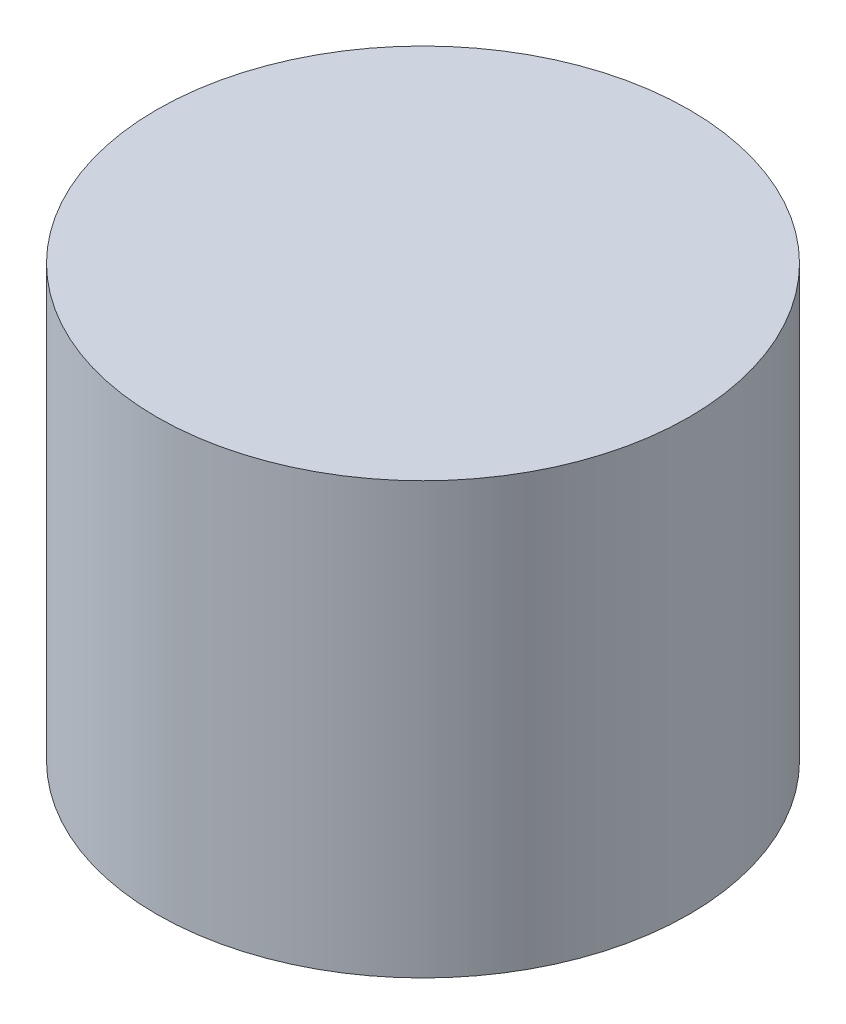
from build123d import *

# Parameters (mm, degrees)
SKETCH2_R           = 11.5
BOSS_EXTRUDE1_DEPTH = 18.6


with BuildPart() as part:
    # Sketch2 → Boss-Extrude1 (new body)
    with BuildSketch(Plane(origin=(0, 0, 0), x_dir=(1, 0, 0), z_dir=(0, 1, 0))):
        with Locations(Location((0, 0, 0), (0, 0, 270))):
            Circle(SKETCH2_R)
    extrude(amount=-BOSS_EXTRUDE1_DEPTH)


solid = part.part
